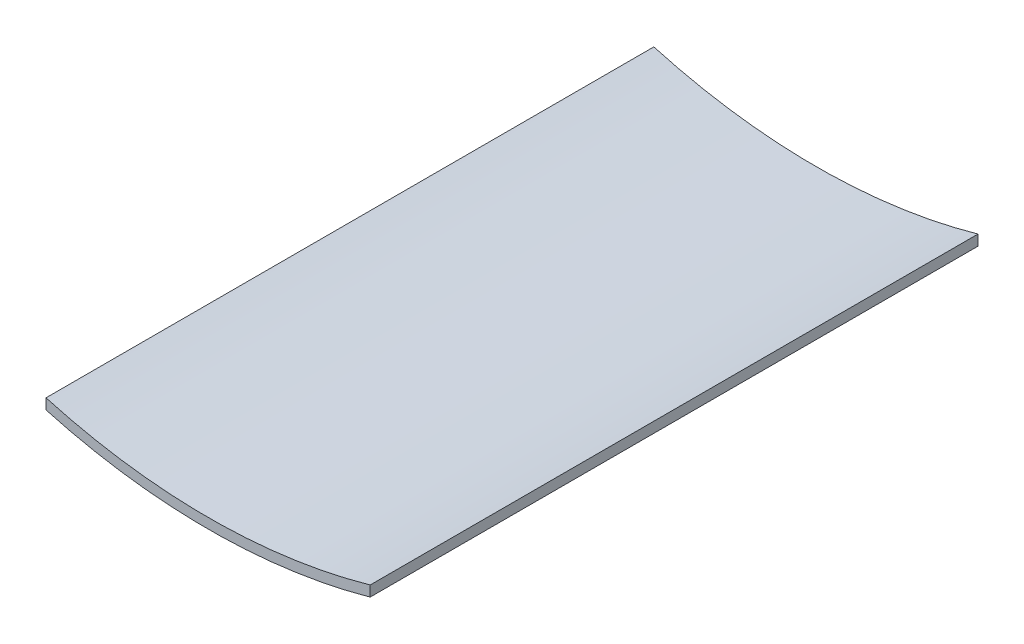
from build123d import *

# Parameters (mm, degrees)
BOSS_EXTRUDE1_DEPTH = 190.5


with BuildPart() as part:
    # Sketch1 → Boss-Extrude1 (new body)
    with BuildSketch(Plane(origin=(0, 0, 0), x_dir=(0, 1, 0), z_dir=(0, 0, 1))):
        with BuildLine():
            Line((-182.2837154, 50.8), (-178.985538592, 50.8))
            ThreePointArc((-178.985538592, 50.8), (-186.055, 0), (-178.985538592, -50.8))
            Line((-178.985538592, -50.8), (-182.2837154, -50.8))
            ThreePointArc((-182.2837154, -50.8), (-189.23, 0), (-182.2837154, 50.8))
        make_face()
    extrude(amount=BOSS_EXTRUDE1_DEPTH)


solid = part.part
